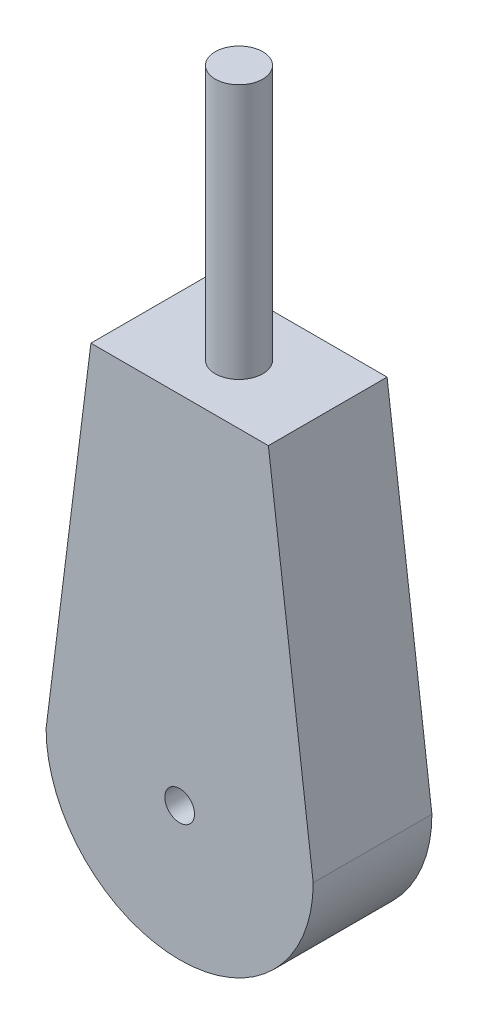
from build123d import *

# Parameters (mm, degrees)
BOSS_EXTRUDE1_DEPTH = 10
SKETCH3_R           = 4
BOSS_EXTRUDE2_DEPTH = 43
SKETCH4_R           = 2.5
CUT_EXTRUDE1_DEPTH  = 5
SKETCH6_R           = 12.5
BOSS_EXTRUDE3_DEPTH = 5
CUT_EXTRUDE2_START  = -5
SKETCH7_R           = 2.5
CUT_EXTRUDE2_DEPTH  = 5


with BuildPart() as part:
    # Sketch1 → Boss-Extrude1 (new, symmetric)
    with BuildSketch(Plane.XY):
        with BuildLine():
            Line((-22.5, 0), (-14.95, 60))
            Line((-14.95, 60), (14.95, 60))
            Line((14.95, 60), (22.5, 0))
            ThreePointArc((22.5, 0), (0, -22.5), (-22.5, 0))
        make_face()
    extrude(amount=BOSS_EXTRUDE1_DEPTH, both=True)

    # Sketch3 → Boss-Extrude2 (add)
    with BuildSketch(Plane(origin=(0, 60, 0), x_dir=(1, 0, 0), z_dir=(0, 1, 0))):
        with Locations(Location((0, 0, 0), (0, 0, 270))):
            Circle(SKETCH3_R)
    extrude(amount=BOSS_EXTRUDE2_DEPTH)

    # Sketch4 → Cut-Extrude1 (cut)
    with BuildSketch(Plane.XY.offset(10)):
        Circle(SKETCH4_R)
    extrude(amount=-CUT_EXTRUDE1_DEPTH, mode=Mode.SUBTRACT)

    # Sketch6 → Boss-Extrude3 (add)
    with BuildSketch(Plane(origin=(0, 0, -10), x_dir=(-1, 0, 0), z_dir=(0, 0, -1))):
        with Locations(Location((0, 0, 0), (0, 0, 180))):
            Circle(SKETCH6_R)
    extrude(amount=BOSS_EXTRUDE3_DEPTH)

    # Sketch7 → Cut-Extrude2 (cut)
    with BuildSketch(Plane(origin=(0, 0, -15), x_dir=(-1, 0, 0), z_dir=(0, 0, -1)).offset(CUT_EXTRUDE2_START)):
        with Locations(Location((0, 0, 0), (0, 0, 180))):
            Circle(SKETCH7_R)
    extrude(amount=CUT_EXTRUDE2_DEPTH, mode=Mode.SUBTRACT)


solid = part.part
